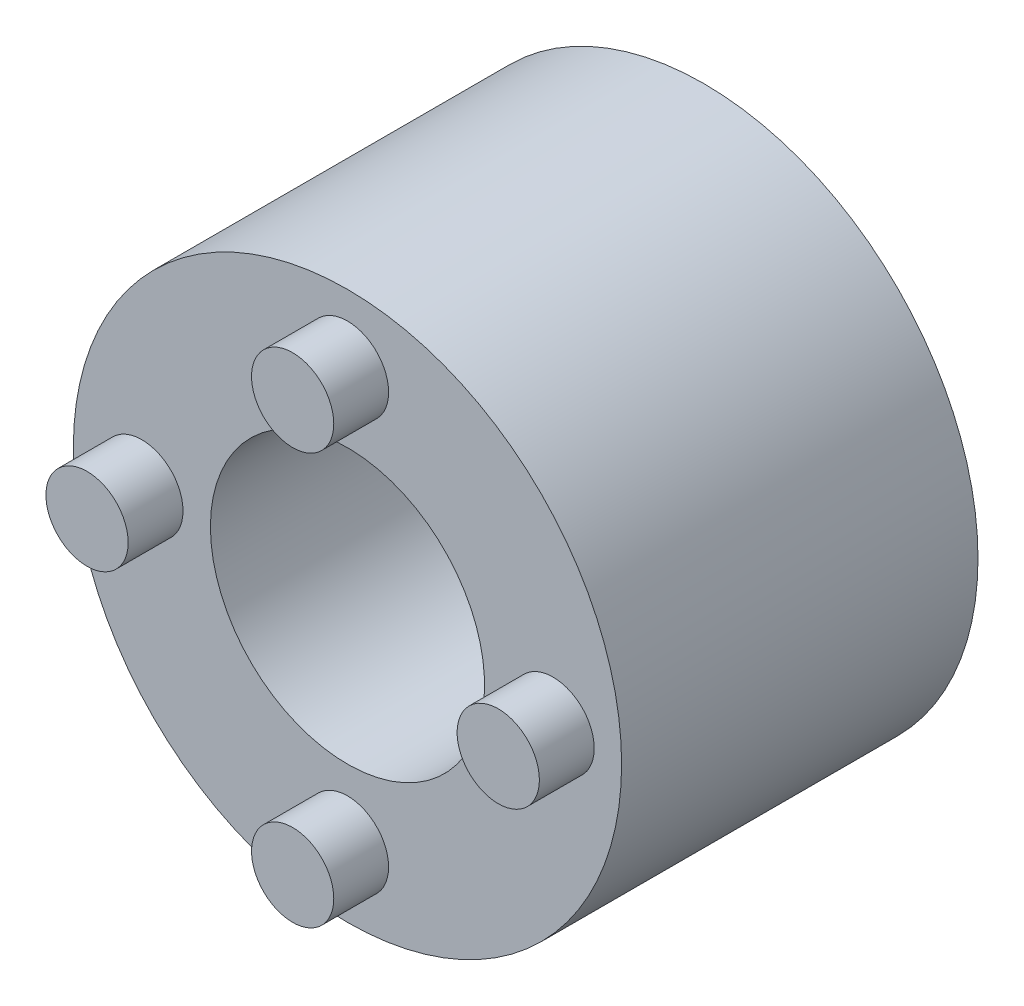
from build123d import *

# Parameters (mm, degrees)
SKETCH_1_R      = 10
SKETCH_1_R_2    = 5
EXTRUDE_1_DEPTH = 6.5
SKETCH_2_R      = 1.5
EXTRUDE_2_DEPTH = 2


with BuildPart() as part:
    # 草图1 → 凸台-拉伸1 (new, symmetric)
    with BuildSketch(Plane.XY):
        with Locations(Location((0, 0, 0), (0, 0, 180))):
            Circle(SKETCH_1_R)
        with Locations(Location((0, 0, 0), (0, 0, 180))):
            Circle(SKETCH_1_R_2, mode=Mode.SUBTRACT)
    extrude(amount=EXTRUDE_1_DEPTH, both=True)

    # 草图2 → 凸台-拉伸2 (add, symmetric)
    with BuildSketch(Plane.XY.offset(6.5)):
        with Locations((0, 7.5)):
            Circle(SKETCH_2_R)
        with Locations((7.5, 0)):
            Circle(SKETCH_2_R)
        with Locations((0, -7.5)):
            Circle(SKETCH_2_R)
        with Locations((-7.5, 0)):
            Circle(SKETCH_2_R)
    extrude(amount=EXTRUDE_2_DEPTH, both=True)


solid = part.part
